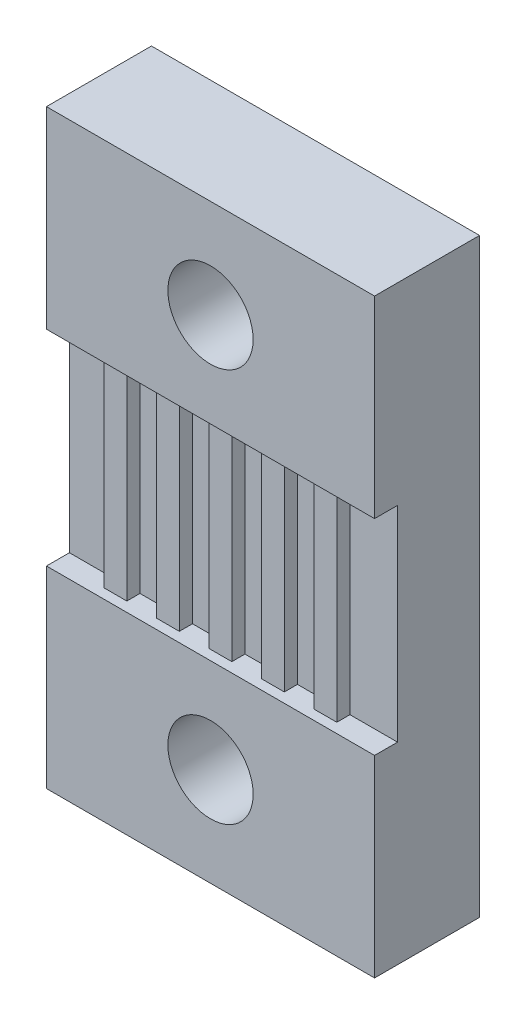
from build123d import *

# Parameters (mm, degrees)
SKETCH1_W           = 12.7
SKETCH1_H           = 22.86
SKETCH1_R           = 1.65
BOSS_EXTRUDE1_DEPTH = 3.175
SKETCH2_W           = 12.7
SKETCH2_H           = 7.46125
SKETCH2_R           = 1.65
BOSS_EXTRUDE2_DEPTH = 0.889
BOSS_EXTRUDE3_REACH = 19.145
SKETCH3_W           = 0.889
SKETCH3_H           = 0.508
LPATTERN1_COUNT     = 3
LPATTERN1_PITCH     = 2.032
LPATTERN1_COL_COUNT = 3
LPATTERN1_COL_PITCH = 2.032


with BuildPart() as part:
    # Sketch1 → Boss-Extrude1 (new body)
    with BuildSketch(Plane.XY):
        Rectangle(SKETCH1_W, SKETCH1_H)
        with Locations((0, 7.62)):
            Circle(SKETCH1_R, mode=Mode.SUBTRACT)
        with Locations(Location((0, -7.62, 0), (0, 0, 180))):
            Circle(SKETCH1_R, mode=Mode.SUBTRACT)
    extrude(amount=BOSS_EXTRUDE1_DEPTH)

    # Sketch2 → Boss-Extrude2 (add)
    # profile 1 of 2: a face of its own
    with BuildSketch(Plane.XY.offset(3.175)):
        with Locations((0, -7.699375)):
            Rectangle(SKETCH2_W, SKETCH2_H)
        with Locations(Location((0, -7.62, 0), (0, 0, 180))):
            Circle(SKETCH2_R, mode=Mode.SUBTRACT)
    # profile 2 of 2: a face of its own
    with BuildSketch(Plane.XY.offset(3.175)):
        with Locations((0, 7.699375)):
            Rectangle(SKETCH2_W, SKETCH2_H)
        with Locations((0, 7.62)):
            Circle(SKETCH2_R, mode=Mode.SUBTRACT)
    extrude(amount=BOSS_EXTRUDE2_DEPTH)

    # Sketch3 → Boss-Extrude3 (add, up to next)
    with BuildSketch(Plane.XZ.offset(-3.96875), mode=Mode.PRIVATE) as boss_extrude3_sk1:
        with Locations((0, 3.429)):
            Rectangle(SKETCH3_W, SKETCH3_H)
    boss_extrude3_tool1 = extrude(boss_extrude3_sk1.sketch, amount=BOSS_EXTRUDE3_REACH, mode=Mode.PRIVATE) - part.part
    boss_extrude3 = boss_extrude3_tool1.solids().sort_by_distance((0, 3.96875, 3.429))[0]
    add(boss_extrude3)

    # LPattern1: Boss-Extrude3 ×3
    with Locations(*[(i * LPATTERN1_PITCH, 0, 0) for i in range(1, LPATTERN1_COUNT)]):
        add(boss_extrude3)

    # LPattern1 col: Boss-Extrude3 ×3
    with Locations(*[(-i * LPATTERN1_COL_PITCH, 0, 0) for i in range(1, LPATTERN1_COL_COUNT)]):
        add(boss_extrude3)


solid = part.part
